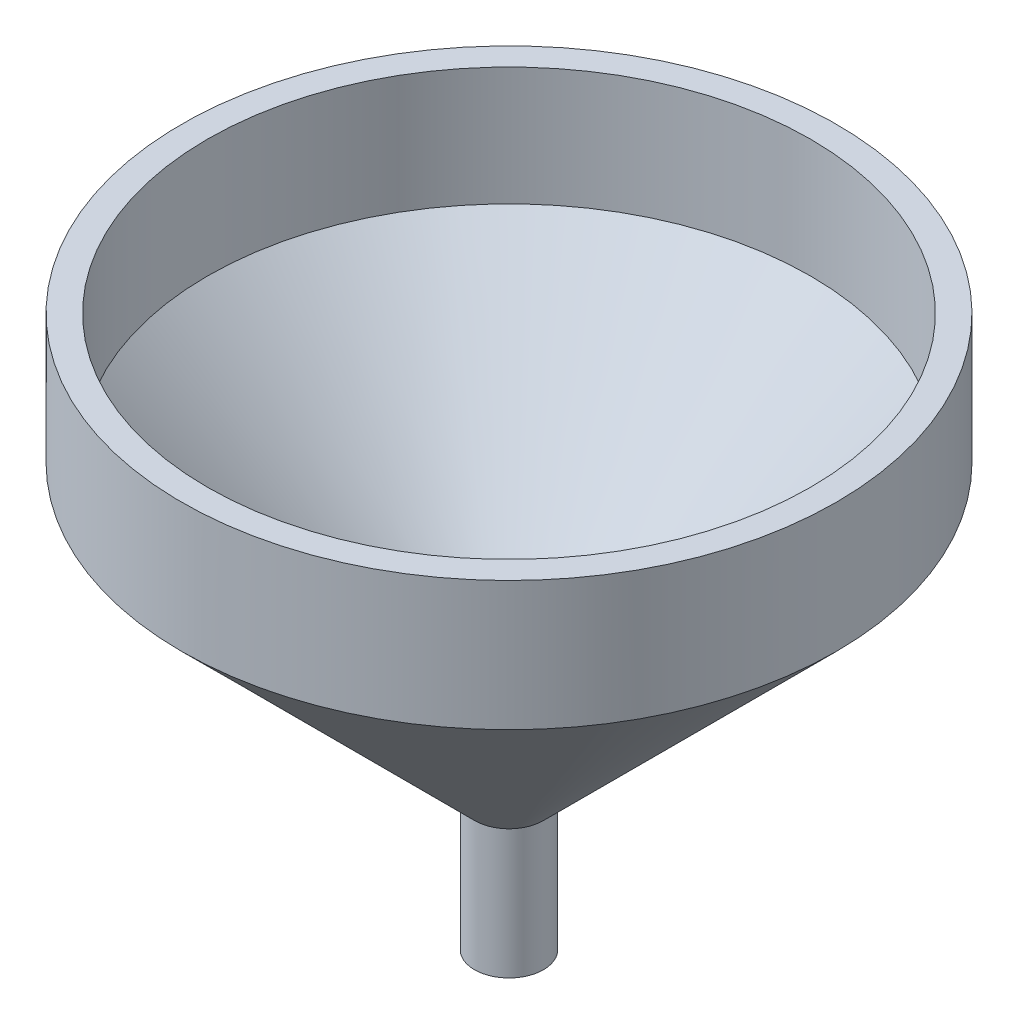
from build123d import *


with BuildPart() as part:
    # basis → roteren (revolve)
    with BuildSketch(Plane.XY, mode=Mode.PRIVATE) as roteren_sk:
        Polygon((-2, 0), (-2, 15), (-36, 49), (-36, 64), (-33, 64), (-33, 50.242640687), (0, 17.242640687), (0, 0), align=None)
    revolve(roteren_sk.sketch.rotate(Axis((2, 0, 0), (0, 1, 0)), 180), axis=Axis((2, 0, 0), (0, 1, 0)))


solid = part.part
